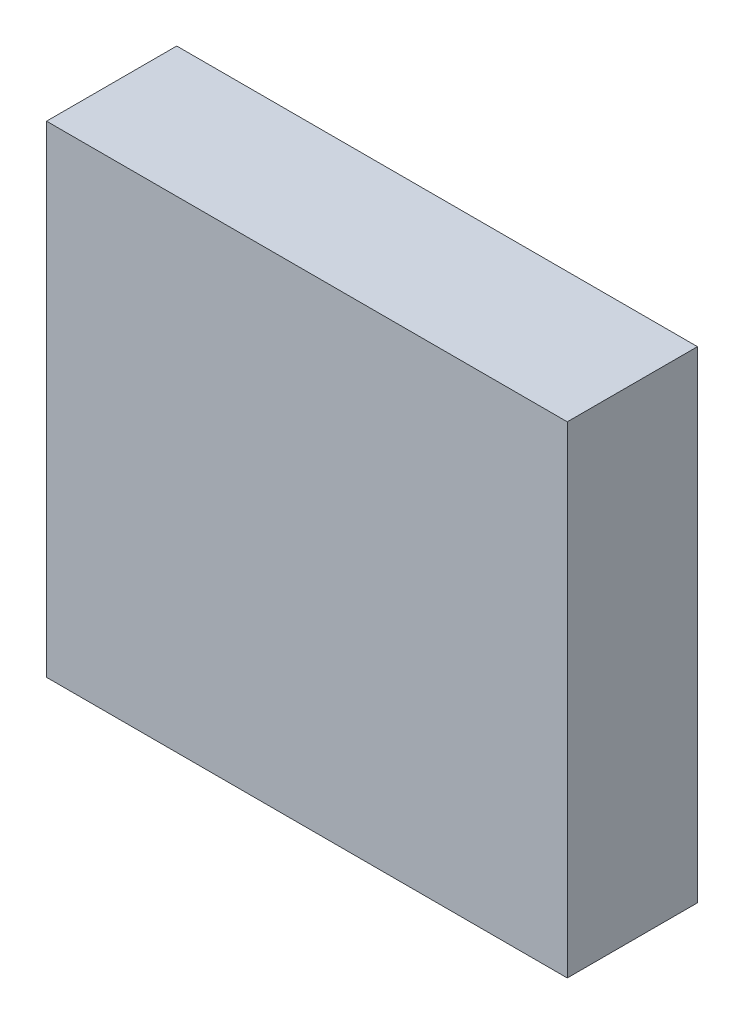
from build123d import *

# Parameters (mm, degrees)
SKETCH1_W           = 40
SKETCH1_H           = 37
BOSS_EXTRUDE1_DEPTH = 10


with BuildPart() as part:
    # Sketch1 → Boss-Extrude1 (new body)
    with BuildSketch(Plane.XY):
        with Locations((20, 18.5)):
            Rectangle(SKETCH1_W, SKETCH1_H)
    extrude(amount=BOSS_EXTRUDE1_DEPTH)


solid = part.part
